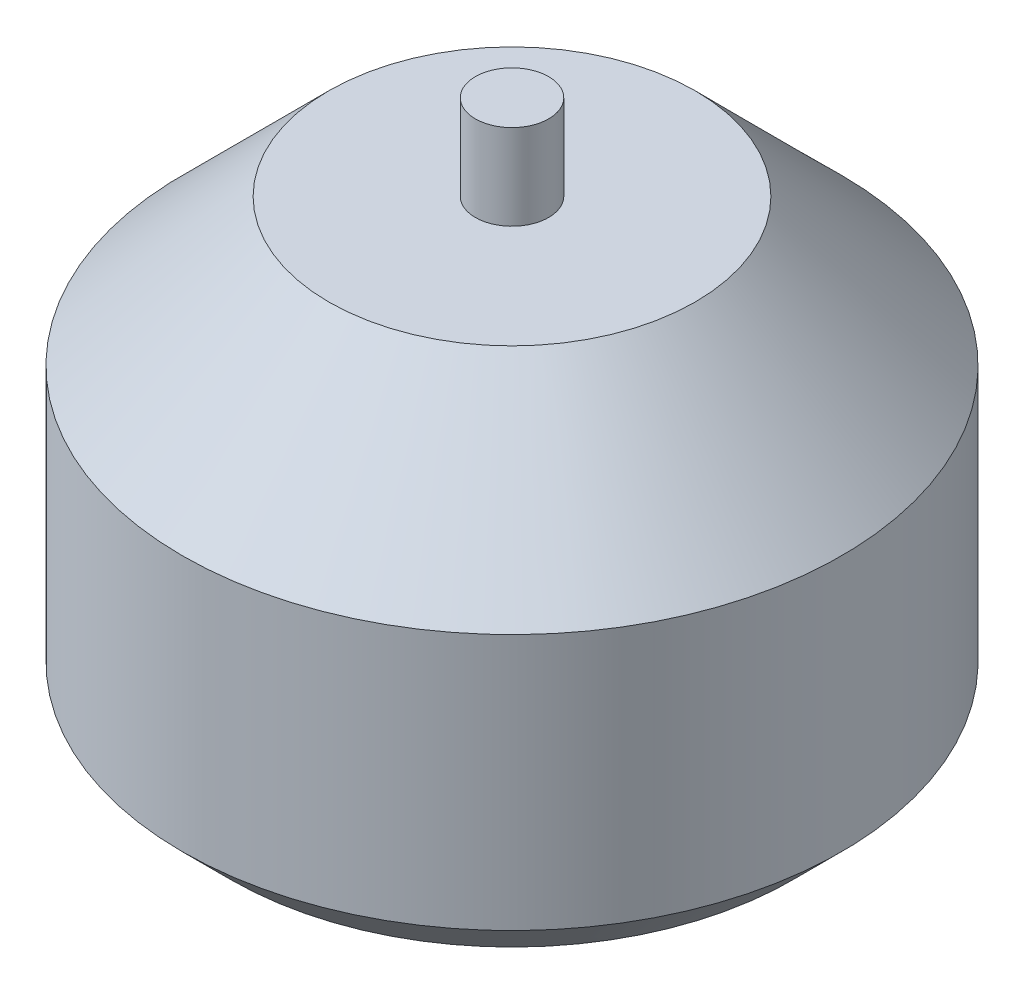
from build123d import *

# Parameters (mm, degrees)
SKETCH1_R           = 13.5
BOSS_EXTRUDE1_DEPTH = 18.5
SKETCH2_R           = 1.5
BOSS_EXTRUDE2_DEPTH = 3.5
BOSS_EXTRUDE3_START = 3
SKETCH3_R           = 1.5
BOSS_EXTRUDE3_DEPTH = 3
CHAMFER1_SIZE       = 6
CHAMFER2_SIZE       = 2


with BuildPart() as part:
    # Sketch1 → Boss-Extrude1 (new body)
    with BuildSketch(Plane(origin=(0, 0, 0), x_dir=(1, 0, 0), z_dir=(0, 1, 0))):
        with Locations(Location((0, 0, 0), (0, 0, 270))):
            Circle(SKETCH1_R)
    extrude(amount=BOSS_EXTRUDE1_DEPTH)

    # Sketch2 → Boss-Extrude2 (add)
    with BuildSketch(Plane(origin=(0, 18.5, 0), x_dir=(1, 0, 0), z_dir=(0, 1, 0))):
        with Locations(Location((0, 0, 0), (0, 0, 270))):
            Circle(SKETCH2_R)
    extrude(amount=BOSS_EXTRUDE2_DEPTH)

    # Sketch3 → Boss-Extrude3 (add)
    with BuildSketch(Plane.XZ.offset(BOSS_EXTRUDE3_START)):
        with Locations(Location((0, 0, 0), (0, 0, 90))):
            Circle(SKETCH3_R)
    extrude(amount=-BOSS_EXTRUDE3_DEPTH)

    # Chamfer1
    chamfer1_edges = [part.edges().sort_by_distance(p)[0] for p in [
        (0, 18.5, -13.5),
    ]]
    chamfer(chamfer1_edges, length=CHAMFER1_SIZE)

    # Chamfer2
    chamfer2_edges = [part.edges().sort_by_distance(p)[0] for p in [
        (0, 0, -13.5),
    ]]
    chamfer(chamfer2_edges, length=CHAMFER2_SIZE)


solid = part.part
